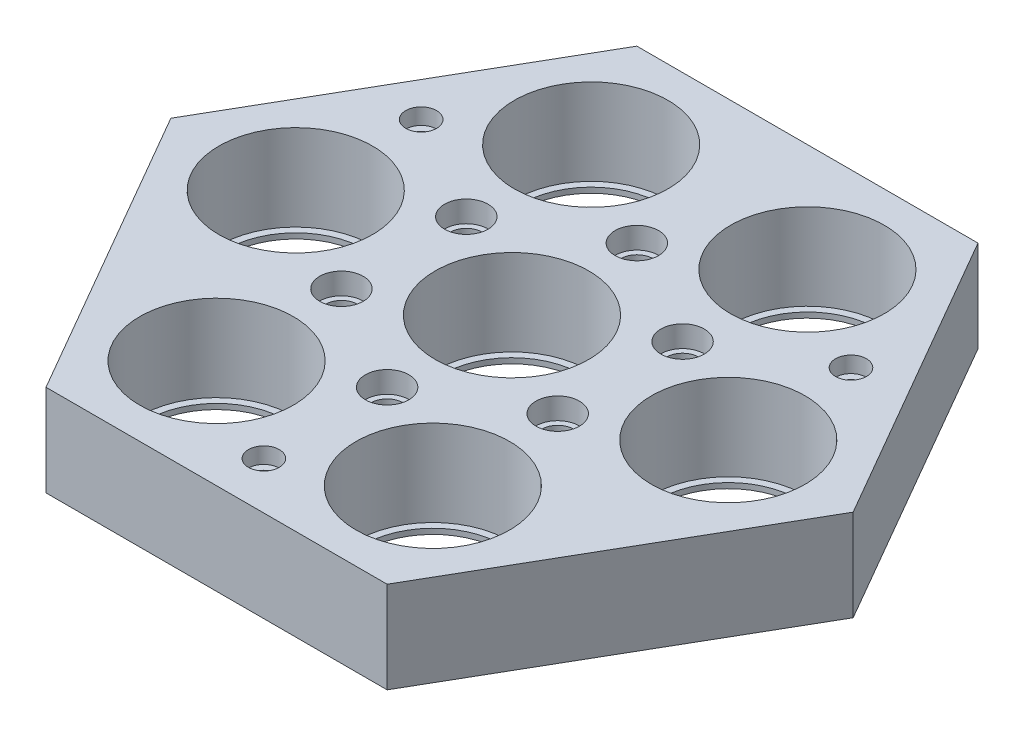
from build123d import *

# Parameters (mm, degrees)
SKETCH1_R           = 13
BOSS_EXTRUDE1_DEPTH = 1
SKETCH2_R           = 14.3125
BOSS_EXTRUDE2_DEPTH = 16.05
SKETCH3_R           = 4.05
CUT_EXTRUDE1_DEPTH  = 4
SKETCH5_R           = 1.55
CUT_EXTRUDE3_DEPTH  = 86.802602692
SKETCH5_3_R         = 2.875
CUT_EXTRUDE4_DEPTH  = 3
SKETCH6_R           = 3
CUT_EXTRUDE5_DEPTH  = 86.09810003


with BuildPart() as part:
    # Sketch1 → Boss-Extrude1 (new body)
    with BuildSketch(Plane(origin=(0, 0, 0), x_dir=(1, 0, 0), z_dir=(0, 1, 0))):
        Polygon((31.783607924, -55.050823773), (63.567215848, 0), (31.783607924, 55.050823773), (-31.783607924, 55.050823773), (-63.567215848, 0), (-31.783607924, -55.050823773), align=None)
        with Locations((-20.15, -34.900823773)):
            Circle(SKETCH1_R, mode=Mode.SUBTRACT)
        with Locations((20.15, -34.900823773)):
            Circle(SKETCH1_R, mode=Mode.SUBTRACT)
        with Locations((-40.3, 0)):
            Circle(SKETCH1_R, mode=Mode.SUBTRACT)
        with Locations((-20.15, 34.900823773)):
            Circle(SKETCH1_R, mode=Mode.SUBTRACT)
        Circle(SKETCH1_R, mode=Mode.SUBTRACT)
        with Locations((40.3, 0)):
            Circle(SKETCH1_R, mode=Mode.SUBTRACT)
        with Locations((20.15, 34.900823773)):
            Circle(SKETCH1_R, mode=Mode.SUBTRACT)
    extrude(amount=BOSS_EXTRUDE1_DEPTH)

    # Sketch2 → Boss-Extrude2 (add)
    with BuildSketch(Plane(origin=(0, 1, 0), x_dir=(1, 0, 0), z_dir=(0, 1, 0))):
        Polygon((-63.567215848, 0), (-31.783607924, 55.050823773), (31.783607924, 55.050823773), (63.567215848, 0), (31.783607924, -55.050823773), (-31.783607924, -55.050823773), align=None)
        with Locations((-40.3, 0)):
            Circle(SKETCH2_R, mode=Mode.SUBTRACT)
        with Locations((-20.15, 34.900823773)):
            Circle(SKETCH2_R, mode=Mode.SUBTRACT)
        with Locations((20.15, 34.900823773)):
            Circle(SKETCH2_R, mode=Mode.SUBTRACT)
        with Locations((40.3, 0)):
            Circle(SKETCH2_R, mode=Mode.SUBTRACT)
        with Locations((20.15, -34.900823773)):
            Circle(SKETCH2_R, mode=Mode.SUBTRACT)
        with Locations((-20.15, -34.900823773)):
            Circle(SKETCH2_R, mode=Mode.SUBTRACT)
        Circle(SKETCH2_R, mode=Mode.SUBTRACT)
    extrude(amount=BOSS_EXTRUDE2_DEPTH)

    # Sketch3 → Cut-Extrude1 (cut)
    with BuildSketch(Plane(origin=(0, 17.05, 0), x_dir=(1, 0, 0), z_dir=(0, 1, 0))):
        with Locations((-20.15, 11.633607924)):
            Circle(SKETCH3_R)
        with Locations((0, 23.267215848)):
            Circle(SKETCH3_R)
        with Locations((20.15, 11.633607924)):
            Circle(SKETCH3_R)
        with Locations((20.15, -11.633607924)):
            Circle(SKETCH3_R)
        with Locations((0, -23.267215848)):
            Circle(SKETCH3_R)
        with Locations((-20.15, -11.633607924)):
            Circle(SKETCH3_R)
    extrude(amount=-CUT_EXTRUDE1_DEPTH, mode=Mode.SUBTRACT)

    # Sketch5 → Cut-Extrude3 (cut, through all)
    with BuildSketch(Plane(origin=(0, 17.05, 0), x_dir=(1, 0, 0), z_dir=(0, 1, 0))):
        with Locations((-40.046128973, 23.120643343)):
            Circle(SKETCH5_R)
        with Locations((40.046128973, 23.120643343)):
            Circle(SKETCH5_R)
        with Locations((0, -46.241286685)):
            Circle(SKETCH5_R)
    extrude(amount=-CUT_EXTRUDE3_DEPTH, mode=Mode.SUBTRACT)

    # Sketch5<3> → Cut-Extrude4 (cut)
    with BuildSketch(Plane(origin=(0, 17.05, 0), x_dir=(1, 0, 0), z_dir=(0, 1, 0))):
        with Locations((-40.046128973, 23.120643343)):
            Circle(SKETCH5_3_R)
        with Locations((40.046128973, 23.120643343)):
            Circle(SKETCH5_3_R)
        with Locations((0, -46.241286685)):
            Circle(SKETCH5_3_R)
    extrude(amount=-CUT_EXTRUDE4_DEPTH, mode=Mode.SUBTRACT)

    # Sketch6 → Cut-Extrude5 (cut, through all)
    with BuildSketch(Plane(origin=(0, 13.05, 0), x_dir=(1, 0, 0), z_dir=(0, 1, 0))):
        with Locations((-20.15, -11.633607924)):
            Circle(SKETCH6_R)
        with Locations((-20.15, 11.633607924)):
            Circle(SKETCH6_R)
        with Locations((0, 23.267215848)):
            Circle(SKETCH6_R)
        with Locations((20.15, 11.633607924)):
            Circle(SKETCH6_R)
        with Locations((20.15, -11.633607924)):
            Circle(SKETCH6_R)
        with Locations((0, -23.267215848)):
            Circle(SKETCH6_R)
    extrude(amount=-CUT_EXTRUDE5_DEPTH, mode=Mode.SUBTRACT)


solid = part.part
